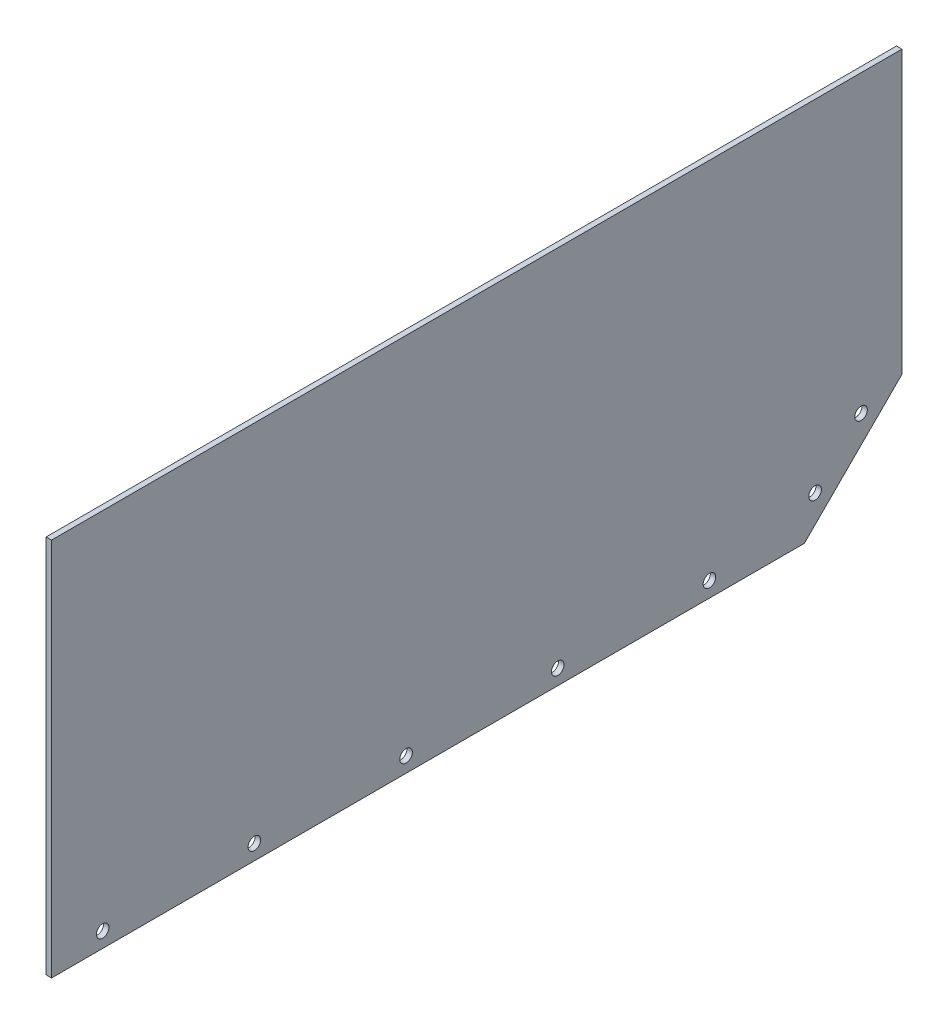
from build123d import *

# Parameters (mm, degrees)
SKETCH1_W           = 498.348
SKETCH1_H           = 165.1
BOSS_EXTRUDE1_DEPTH = 1.5875
BOSS_EXTRUDE2_DEPTH = 3.175
CUT_EXTRUDE1_DEPTH  = 286.681383539
LPATTERN1_COUNT     = 5
LPATTERN1_PITCH     = 88.9
CUT_EXTRUDE2_DEPTH  = 286.681383539
LPATTERN2_COUNT     = 2
LPATTERN2_PITCH     = 38.1


with BuildPart() as part:
    # Sketch1 → Boss-Extrude1 (new, symmetric)
    with BuildSketch(Plane(origin=(0, 0, 0), x_dir=(0, 0, -1), z_dir=(1, 0, 0))):
        Rectangle(SKETCH1_W, SKETCH1_H)
    extrude(amount=BOSS_EXTRUDE1_DEPTH, both=True)

    # Sketch2 → Boss-Extrude2 (add)
    with BuildSketch(Plane(origin=(1.5875, 0, 0), x_dir=(0, 0, -1), z_dir=(1, 0, 0))):
        Polygon((192.024, -139.7), (249.174, -82.55), (-249.174, -82.55), (-249.174, -139.7), align=None)
    extrude(amount=-BOSS_EXTRUDE2_DEPTH)

    # Sketch3 → Cut-Extrude1 (cut, through all)
    with BuildSketch(Plane.ZY.offset(1.5875)):
        with BuildLine():
            ThreePointArc((222.877, -130.81), (216.603382579, -128.211382579), (219.202, -134.485))
            Line((219.202, -134.485), (219.202, -130.81))
            Line((219.202, -130.81), (222.877, -130.81))
        make_face()
        with BuildLine():
            Line((219.202, -130.81), (219.202, -134.485))
            ThreePointArc((219.202, -134.485), (221.800617421, -133.408617421), (222.877, -130.81))
            Line((222.877, -130.81), (219.202, -130.81))
        make_face()
    cut_extrude1 = extrude(amount=-CUT_EXTRUDE1_DEPTH, mode=Mode.SUBTRACT)

    # LPattern1: Cut-Extrude1 ×5
    with Locations(*[(0, 0, -i * LPATTERN1_PITCH) for i in range(1, LPATTERN1_COUNT)]):
        add(cut_extrude1, mode=Mode.SUBTRACT)

    # Sketch4 → Cut-Extrude2 (cut, symmetric)
    with BuildSketch(Plane.ZY.offset(1.5875)):
        with BuildLine():
            ThreePointArc((-194.635179285, -117.249359697), (-199.716540899, -113.854102415), (-200.908796706, -119.847977118))
            Line((-200.908796706, -119.847977118), (-198.310179285, -117.249359697))
            Line((-198.310179285, -117.249359697), (-195.711561864, -119.847977118))
            ThreePointArc((-195.711561864, -119.847977118), (-194.914922003, -118.655721311), (-194.635179285, -117.249359697))
        make_face()
        with BuildLine():
            Line((-198.310179285, -117.249359697), (-200.908796706, -119.847977118))
            ThreePointArc((-200.908796706, -119.847977118), (-198.310179285, -120.924359697), (-195.711561864, -119.847977118))
            Line((-195.711561864, -119.847977118), (-198.310179285, -117.249359697))
        make_face()
    cut_extrude2 = extrude(amount=CUT_EXTRUDE2_DEPTH, both=True, mode=Mode.SUBTRACT)

    # LPattern2: Cut-Extrude2 ×2
    with Locations(*[Vector(0, 0.7071067811865446, -0.7071067811865507) * (i * LPATTERN2_PITCH) for i in range(1, LPATTERN2_COUNT)]):
        add(cut_extrude2, mode=Mode.SUBTRACT)


solid = part.part
